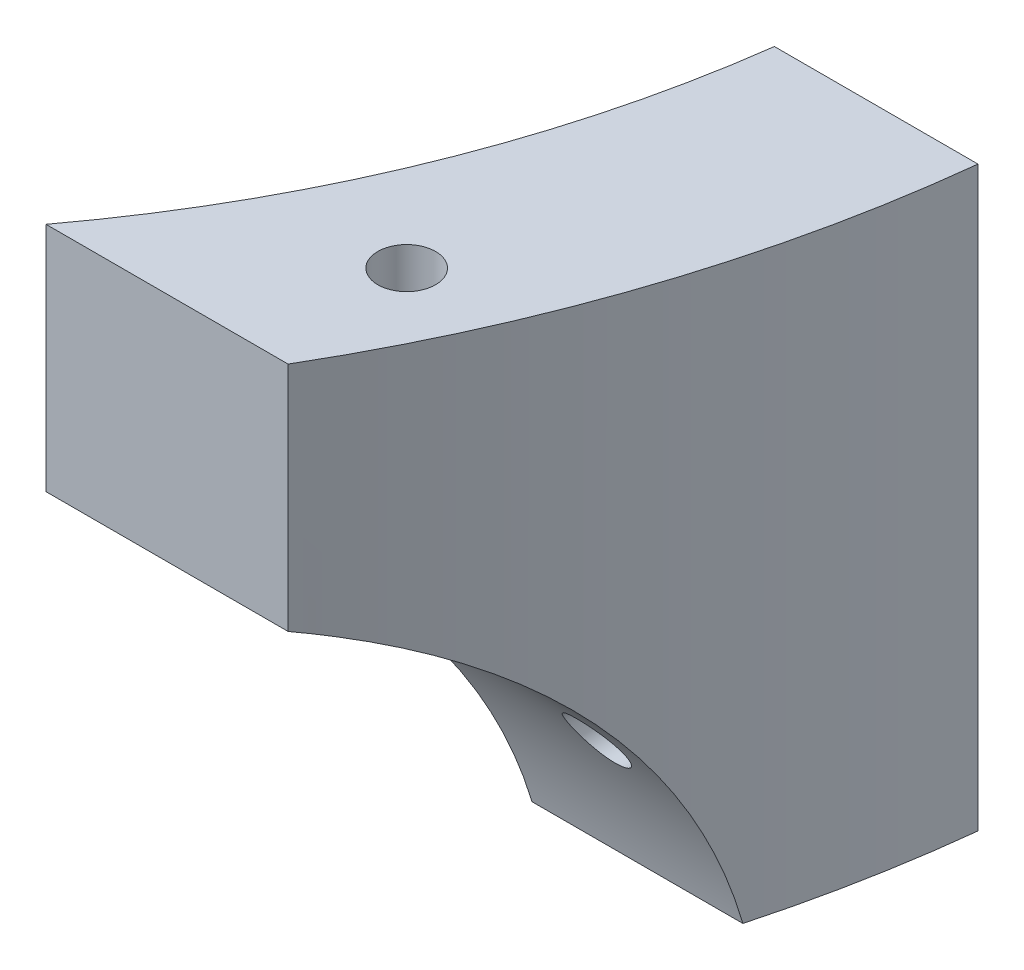
from build123d import *

# Parameters (mm, degrees)
BOSS_EXTRUDE1_DEPTH      = 60
SKETCH25_W               = 5.5
SKETCH25_H               = 17
BOSS_EXTRUDE3_DEPTH      = 20
FILLET1_R                = 2.3
SKETCH28_W               = 8
SKETCH28_H               = 10
CUT_EXTRUDE17_DEPTH      = 265
CUT_EXTRUDE19_DEPTH      = 165.638713704
CUT_EXTRUDE19_DEPTH_BACK = 165.638713704
SKETCH30_W               = 183.61
SKETCH30_H               = 30
CUT_EXTRUDE20_DEPTH      = 165.638713704
CUT_EXTRUDE20_DEPTH_BACK = 165.638713704
SKETCH32_W               = 3
SKETCH32_H               = 14
BOSS_EXTRUDE4_DEPTH      = 40
CUT_EXTRUDE21_DEPTH      = 164.320868385
CUT_EXTRUDE21_DEPTH_BACK = 164.320868385
CUT_EXTRUDE22_DEPTH      = 164.320868502
CUT_EXTRUDE22_DEPTH_BACK = 164.320868502
SKETCH40_W               = 31.800896411
SKETCH40_H               = 59.801829262
CUT_EXTRUDE23_DEPTH      = 55
SKETCH41_R               = 2
CUT_EXTRUDE24_DEPTH      = 55
SKETCH42_R               = 2
CUT_EXTRUDE25_DEPTH      = 55


with BuildPart() as part:
    # Sketch1 → Boss-Extrude1 (new body)
    with BuildSketch(Plane(origin=(0, 0, 0), x_dir=(1, 0, 0), z_dir=(0, 1, 0))):
        with BuildLine():
            Line((91.805, -10), (90.252689849, -10))
            ThreePointArc((90.252689849, -10), (0, -90.805), (-90.252689849, -10))
            Line((-90.252689849, -10), (-91.805, -10))
            Line((-91.805, -10), (-91.805, 20))
            Line((-91.805, 20), (-76.805, 20))
            Line((-76.805, 20), (-76.805, 0))
            ThreePointArc((-76.805, 0), (0, -76.805), (76.805, 0))
            Line((76.805, 0), (76.805, 20))
            Line((76.805, 20), (91.805, 20))
            Line((91.805, 20), (91.805, -10))
        make_face()
    extrude(amount=-BOSS_EXTRUDE1_DEPTH)

    # Sketch25 → Boss-Extrude3 (add)
    with BuildSketch(Plane(origin=(0, -60, 0), x_dir=(-1, 0, 0), z_dir=(0, -1, 0))):
        with Locations((84.305, 5)):
            Rectangle(SKETCH25_W, SKETCH25_H)
        with Locations((-84.305, 5)):
            Rectangle(SKETCH25_W, SKETCH25_H)
    extrude(amount=BOSS_EXTRUDE3_DEPTH)

    # Fillet1
    fillet1_edges = [part.edges().sort_by_distance(p)[0] for p in [
        (84.305, -60, 3.5),
        (81.555, -60, -5),
        (87.055, -60, -5),
        (84.305, -60, -13.5),
        (-84.305, -60, 3.5),
        (-87.055, -60, -5),
        (-81.555, -60, -5),
        (-84.305, -60, -13.5),
    ]]
    fillet(fillet1_edges, radius=FILLET1_R)

    # Sketch28 → Cut-Extrude17 (cut)
    with BuildSketch(Plane(origin=(91.805, 0, 0), x_dir=(0, 0, -1), z_dir=(1, 0, 0))):
        with Locations((5, -42)):
            Rectangle(SKETCH28_W, SKETCH28_H)
    extrude(amount=-CUT_EXTRUDE17_DEPTH, mode=Mode.SUBTRACT)

    # Sketch30 → Cut-Extrude19 (cut, two sides: drawn at the far end of the back side and taken through both)
    with BuildSketch(Plane(origin=(0, 0, -20), x_dir=(-1, 0, 0), z_dir=(0, 0, -1)).offset(-CUT_EXTRUDE19_DEPTH_BACK)):
        with Locations((0, -15)):
            Rectangle(SKETCH30_W, SKETCH30_H)
    extrude(amount=CUT_EXTRUDE19_DEPTH + CUT_EXTRUDE19_DEPTH_BACK, mode=Mode.SUBTRACT)

    # Sketch32 → Cut-Extrude20 (cut, two sides: drawn at the far end of the back side and taken through both)
    with BuildSketch(Plane(origin=(0, 0, -20), x_dir=(-1, 0, 0), z_dir=(0, 0, -1)).offset(-CUT_EXTRUDE20_DEPTH_BACK)):
        with Locations((-65.13523483, -44)):
            Rectangle(SKETCH32_W, SKETCH32_H)
        with Locations((-51.773928511, -44)):
            Rectangle(SKETCH32_W, SKETCH32_H)
        with Locations((-84.305, -46)):
            Rectangle(SKETCH32_W, SKETCH32_H)
        with Locations((65.13523483, -44)):
            Rectangle(SKETCH32_W, SKETCH32_H)
        with Locations((51.773928511, -44)):
            Rectangle(SKETCH32_W, SKETCH32_H)
        with Locations((84.305, -46)):
            Rectangle(SKETCH32_W, SKETCH32_H)
    extrude(amount=CUT_EXTRUDE20_DEPTH + CUT_EXTRUDE20_DEPTH_BACK, mode=Mode.SUBTRACT)

    # Sketch33 → Boss-Extrude4 (add)
    with BuildSketch(Plane(origin=(0, -60, 0), x_dir=(-1, 0, 0), z_dir=(0, -1, 0))):
        with BuildLine():
            ThreePointArc((-90.252689849, -10), (-84.815671791, -32.432234638), (-73.898492454, -52.768938193))
            Line((-73.898492454, -52.768938193), (-61.590580503, -45.886909008))
            ThreePointArc((-61.590580503, -45.886909008), (-71.169996018, -28.876282513), (-76.151218145, -10))
            Line((-76.151218145, -10), (-90.252689849, -10))
        make_face()
        with BuildLine():
            ThreePointArc((73.898492454, -52.768938193), (84.815671791, -32.432234638), (90.252689849, -10))
            Line((90.252689849, -10), (76.151218145, -10))
            ThreePointArc((76.151218145, -10), (71.169996018, -28.876282513), (61.590580503, -45.886909008))
            Line((61.590580503, -45.886909008), (73.898492454, -52.768938193))
        make_face()
    extrude(amount=BOSS_EXTRUDE4_DEPTH)

    # Sketch37 → Cut-Extrude21 (cut, two sides: drawn at the far end of the back side and taken through both)
    with BuildSketch(Plane(origin=(0, 0, 0), x_dir=(0, 0, -1), z_dir=(1, 0, 0)).offset(-CUT_EXTRUDE21_DEPTH_BACK)):
        with BuildLine():
            Line((-0.881303102, -100), (-23.690614963, -100))
            ThreePointArc((-23.690614963, -100), (-31.684760451, -85.14357588), (-45.886909008, -76.037606625))
            Line((-45.886909008, -76.037606625), (-45.886909008, -59.917167305))
            Line((-45.886909008, -59.917167305), (-66.948234535, -59.917167305))
            Line((-66.948234535, -59.917167305), (-63.746381293, -92.441906362))
            Line((-63.746381293, -92.441906362), (-47.571757556, -115.346464391))
            Line((-47.571757556, -115.346464391), (-8.086377987, -115.346464391))
            Line((-8.086377987, -115.346464391), (-0.881303102, -100))
        make_face()
    extrude(amount=CUT_EXTRUDE21_DEPTH + CUT_EXTRUDE21_DEPTH_BACK, mode=Mode.SUBTRACT)

    # Sketch38 → Cut-Extrude22 (cut, two sides: drawn at the far end of the back side and taken through both)
    with BuildSketch(Plane(origin=(0, 0, 0), x_dir=(0, 0, -1), z_dir=(1, 0, 0)).offset(-CUT_EXTRUDE22_DEPTH_BACK)):
        Polygon((20, -30), (-90.805, -30), (-90.805, -60), (-10, -60), (-10, -100), (20, -100), (20, -60), align=None)
    extrude(amount=CUT_EXTRUDE22_DEPTH + CUT_EXTRUDE22_DEPTH_BACK, mode=Mode.SUBTRACT)


with BuildPart() as cut_extrude22_piece_1:
    # of the separate pieces the step leaves, piece 1, a body of its own (cut_extrude22_pieces)
    add(part.part.solids().sort_by_distance((76.151218145, -60, 10))[0])

    # Sketch41 → Cut-Extrude24 (cut)
    with BuildSketch(Plane(origin=(0, 0, 10), x_dir=(-1, 0, 0), z_dir=(0, 0, -1))):
        with Locations((-82.252689849, -89.36002802)):
            Circle(SKETCH41_R)
    extrude(amount=-CUT_EXTRUDE24_DEPTH, mode=Mode.SUBTRACT)

    # Sketch42 → Cut-Extrude25 (cut)
    with BuildSketch(Plane(origin=(0, -60, 0), x_dir=(1, 0, 0), z_dir=(0, 1, 0))):
        with Locations(Location((76.708608453, -36.023832562, 0), (0, 0, 270))):
            Circle(SKETCH42_R)
    extrude(amount=-CUT_EXTRUDE25_DEPTH, mode=Mode.SUBTRACT)


with BuildPart() as cut_extrude22_piece_2:
    # of the separate pieces the step leaves, piece 2, a body of its own (cut_extrude22_pieces)
    add(part.part.solids().sort_by_distance((-76.151218145, -60, 10))[0])

    # Sketch40 → Cut-Extrude23 (cut)
    with BuildSketch(Plane(origin=(0, -100, 0), x_dir=(-1, 0, 0), z_dir=(0, -1, 0))):
        with Locations((74.352241644, -39.900914631)):
            Rectangle(SKETCH40_W, SKETCH40_H)
    extrude(amount=-CUT_EXTRUDE23_DEPTH, mode=Mode.SUBTRACT)


solid = cut_extrude22_piece_1.part
